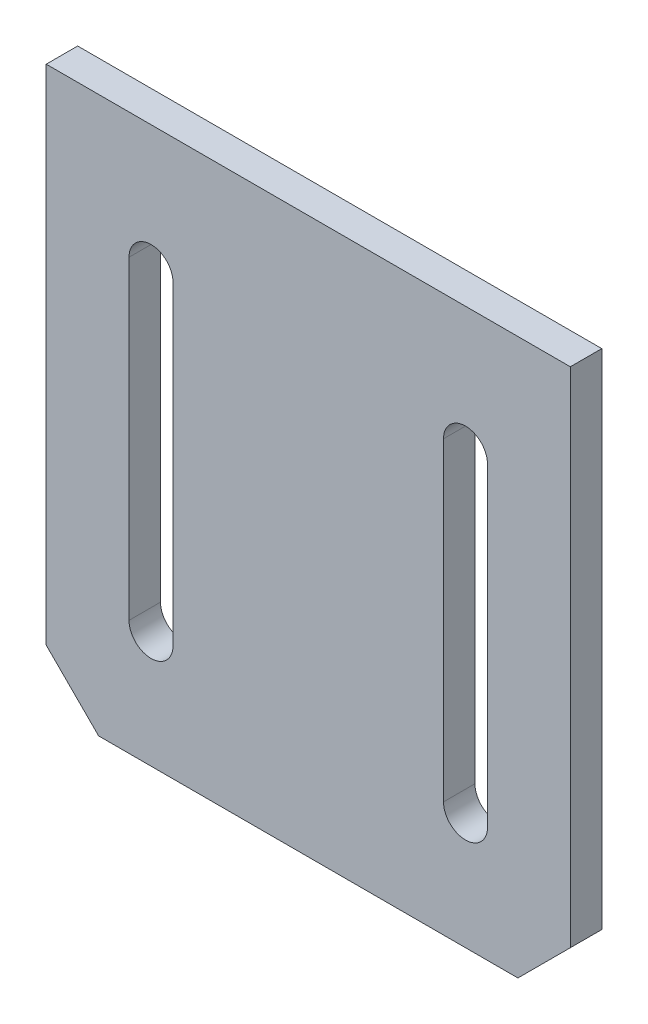
from build123d import *

# Parameters (mm, degrees)
RESSALTO_EXTRUS_O1_DEPTH = 3


with BuildPart() as part:
    # Esboço1 → Ressalto-extrusão1 (new body)
    with BuildSketch(Plane.XY):
        Polygon((-25, -21.5), (-25, 26.5), (25, 26.5), (25, -21.5), (20, -26.5), (-20, -26.5), align=None)
        with BuildLine():
            Line((17.1, 14.5), (17.1, -15.5))
            ThreePointArc((17.1, -15.5), (15, -17.6), (12.9, -15.5))
            Line((12.9, -15.5), (12.9, 14.5))
            ThreePointArc((12.9, 14.5), (15, 16.6), (17.1, 14.5))
        make_face(mode=Mode.SUBTRACT)
        with BuildLine():
            Line((-17.1, 14.5), (-17.1, -15.5))
            ThreePointArc((-17.1, -15.5), (-15, -17.6), (-12.9, -15.5))
            Line((-12.9, -15.5), (-12.9, 14.5))
            ThreePointArc((-12.9, 14.5), (-15, 16.6), (-17.1, 14.5))
        make_face(mode=Mode.SUBTRACT)
    extrude(amount=RESSALTO_EXTRUS_O1_DEPTH)


solid = part.part
